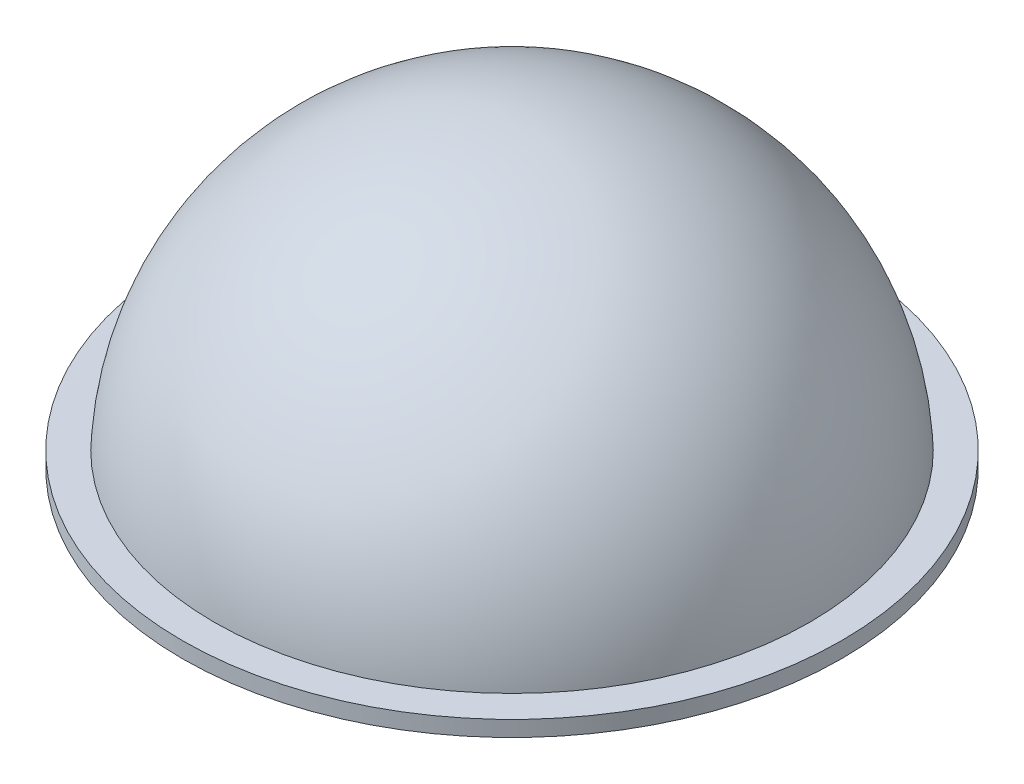
from build123d import *


with BuildPart() as part:
    # Sketch1 → Revolve1 (revolve)
    with BuildSketch(Plane.XY):
        with BuildLine():
            Line((-105, 0), (-105, 5))
            Line((-105, 5), (-94.868329805, 5))
            ThreePointArc((-94.868329805, 5), (-65.383484153, 68.92024376), (0, 95))
            Line((0, 95), (0, 90))
            ThreePointArc((0, 90), (-63.639610307, 63.639610307), (-90, 0))
            Line((-90, 0), (-105, 0))
        make_face()
    revolve(axis=Axis((0, 0, 0), (0, 1, 0)))


solid = part.part
